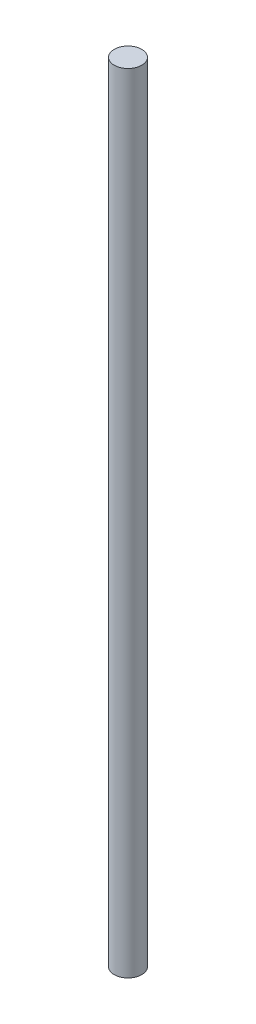
from build123d import *

# Parameters (mm, degrees)
SKETCH1_R           = 3.5
BOSS_EXTRUDE1_DEPTH = 200


with BuildPart() as part:
    # Sketch1 → Boss-Extrude1 (new body)
    with BuildSketch(Plane(origin=(0, 0, 0), x_dir=(1, 0, 0), z_dir=(0, 1, 0))):
        with Locations(Location((0, 0, 0), (0, 0, 270))):
            Circle(SKETCH1_R)
    extrude(amount=BOSS_EXTRUDE1_DEPTH)


solid = part.part
